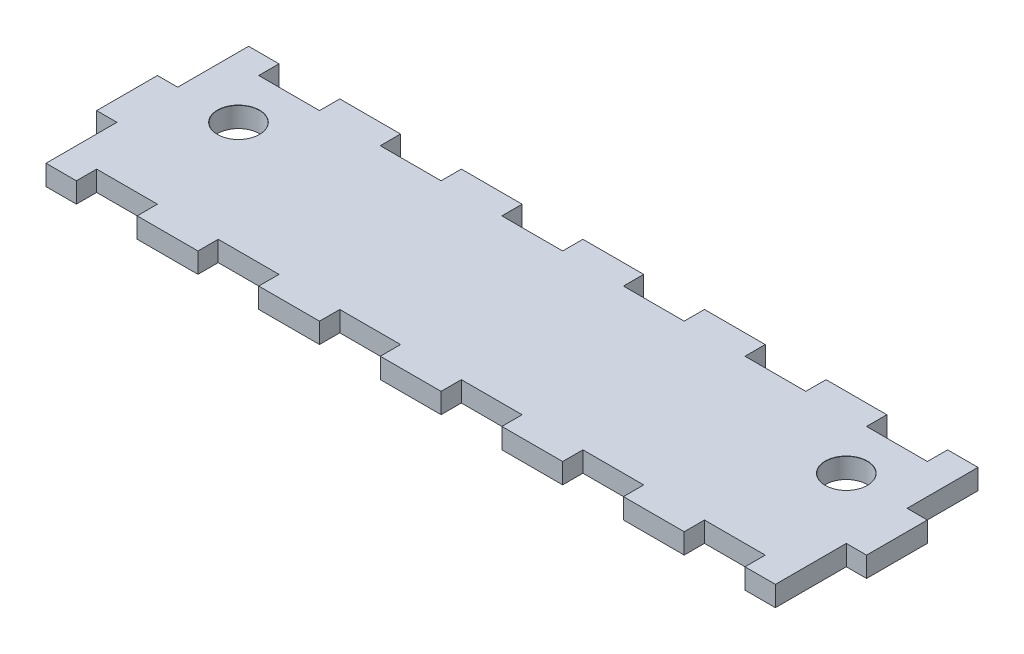
from build123d import *

# Parameters (mm, degrees)
BOSS_EXTRUDE1_DEPTH                 = 1.5
F_6_2_6_2_DIAMETER_HOLE1_AT_2_COUNT = 2
F_6_2_6_2_DIAMETER_HOLE1_AT_2_PITCH = 90


with BuildPart() as part:
    # Sketch1 → Boss-Extrude1 (new, symmetric)
    with BuildSketch(Plane(origin=(0, 0, 0), x_dir=(1, 0, 0), z_dir=(0, 1, 0))):
        Polygon((54, 15), (49.5, 15), (49.5, 12), (40.5, 12), (40.5, 15), (31.5, 15), (31.5, 12), (22.5, 12), (22.5, 15), (13.5, 15), (13.5, 12), (4.5, 12), (4.5, 15), (-4.5, 15), (-4.5, 12), (-13.5, 12), (-13.5, 15), (-22.5, 15), (-22.5, 12), (-31.5, 12), (-31.5, 15), (-40.5, 15), (-40.5, 12), (-49.5, 12), (-49.5, 15), (-54, 15), (-54, 12), (-54, 4.5), (-57, 4.5), (-57, -4.5), (-54, -4.5), (-54, -12), (-54, -15), (-49.5, -15), (-49.5, -12), (-40.5, -12), (-40.5, -15), (-31.5, -15), (-31.5, -12), (-22.5, -12), (-22.5, -15), (-13.5, -15), (-13.5, -12), (-4.5, -12), (-4.5, -15), (4.5, -15), (4.5, -12), (13.5, -12), (13.5, -15), (22.5, -15), (22.5, -12), (31.5, -12), (31.5, -15), (40.5, -15), (40.5, -12), (49.5, -12), (49.5, -15), (54, -15), (54, -12), (54, -4.5), (57, -4.5), (57, 4.5), (54, 4.5), (54, 12), align=None)
    extrude(amount=BOSS_EXTRUDE1_DEPTH, both=True)

    # Sketch4 → Ø6.2 (6.2) Diameter Hole1 (revolve, cut)
    with BuildSketch(Plane(origin=(-45, 1.5, -4.5), x_dir=(0, 0, 1), z_dir=(1, 0, 0))):
        Polygon((0, 0), (0, 3), (3.1, 3), (3.1, 0.025), (3.125, 0), align=None)
    f_6_2_6_2_diameter_hole1 = revolve(axis=Axis((-45, 7.85, -4.5), (0, -1, 0)), mode=Mode.SUBTRACT)

    # Ø6.2 (6.2) Diameter Hole1 at 2: Ø6.2 (6.2) Diameter Hole1 ×2
    with Locations(*[(i * F_6_2_6_2_DIAMETER_HOLE1_AT_2_PITCH, 0, 0) for i in range(1, F_6_2_6_2_DIAMETER_HOLE1_AT_2_COUNT)]):
        add(f_6_2_6_2_diameter_hole1, mode=Mode.SUBTRACT)


solid = part.part
